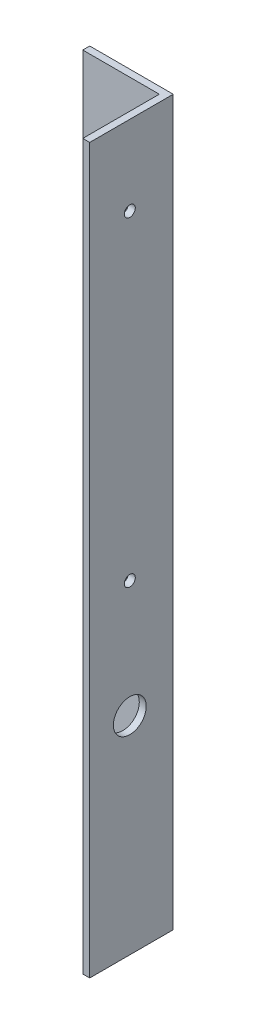
from build123d import *

# Parameters (mm, degrees)
BOSS_EXTRUDE1_DEPTH     = 165.1
CUT_EXTRUDE1_DEPTH      = 171.506664093
CUT_EXTRUDE1_DEPTH_BACK = 171.506664093
SKETCH2_R               = 2.5
SKETCH2_R_2             = 7.5


with BuildPart() as part:
    # Sketch1 → Boss-Extrude1 (new, symmetric)
    with BuildSketch(Plane(origin=(0, 0, 0), x_dir=(1, 0, 0), z_dir=(0, 1, 0))):
        Polygon((15.875, -19.05), (15.875, 15.875), (-19.05, 15.875), (-19.05, 19.05), (19.05, 19.05), (19.05, -19.05), align=None)
    extrude(amount=BOSS_EXTRUDE1_DEPTH, both=True)

    # Sketch2 → Cut-Extrude1 (cut, two sides: drawn at the far end of the back side and taken through both)
    with BuildSketch(Plane(origin=(19.05, 0, 0), x_dir=(0, 0, -1), z_dir=(1, 0, 0)).offset(-CUT_EXTRUDE1_DEPTH_BACK)):
        with Locations((-32.722, 128.8161)):
            Circle(SKETCH2_R)
        with Locations((-32.722, 201.3839)):
            Circle(SKETCH2_R_2)
        with Locations((-32.722, -17.2339)):
            Circle(SKETCH2_R)
        with Locations((-32.722, -70.5739)):
            Circle(SKETCH2_R_2)
        with Locations((-0.762, -70.5739)):
            Circle(SKETCH2_R_2)
        with Locations((-0.762, 201.3839)):
            Circle(SKETCH2_R_2)
        with Locations((-0.762, 128.8161)):
            Circle(SKETCH2_R)
        with Locations((-0.762, -17.2339)):
            Circle(SKETCH2_R)
    extrude(amount=CUT_EXTRUDE1_DEPTH + CUT_EXTRUDE1_DEPTH_BACK, mode=Mode.SUBTRACT)


solid = part.part
